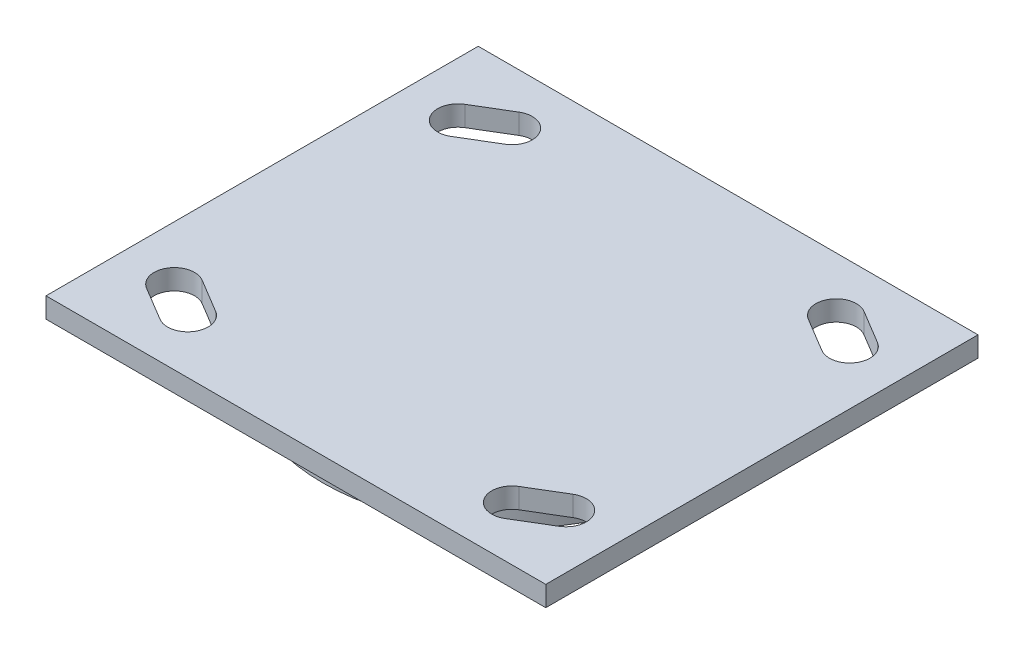
from build123d import *

# Parameters (mm, degrees)
SKETCH1_W               = 117.475
SKETCH1_H               = 4.7625
BOSS_EXTRUDE1_DEPTH     = 50.8
F_1_2_HOLES_DEPTH       = 78.803697293
SKETCH7_W               = 170.933784369
SKETCH7_H               = 70.3072
BOSS_EXTRUDE2_DEPTH     = 164.9349
CUT_EXTRUDE1_DEPTH      = 252.384886958
CUT_EXTRUDE1_DEPTH_BACK = 252.384886958
CUT_EXTRUDE3_DEPTH      = 208.174206511
CUT_EXTRUDE3_DEPTH_BACK = 208.174206511
SKETCH9_OUTSIDE_W       = 162.248
SKETCH9_OUTSIDE_H       = 251.148
BOSS_EXTRUDE3_DEPTH     = 7.9375
SKETCH11_OUTSIDE_W      = 1143.154
SKETCH11_OUTSIDE_H      = 1135.216
SKETCH11_OUTSIDE_R      = 11.1125
CUT_EXTRUDE4_DEPTH      = 255.208337191
CUT_EXTRUDE4_DRAFT      = -60
SKETCH12_R              = 10.795
BOSS_EXTRUDE4_DEPTH     = 64.77
SKETCH13_R              = 298.45
CUT_EXTRUDE5_DEPTH      = 254


with BuildPart() as part:
    # Sketch1 → Boss-Extrude1 (new, symmetric)
    with BuildSketch(Plane.XY):
        with Locations((0, -2.38125)):
            Rectangle(SKETCH1_W, SKETCH1_H)
    extrude(amount=BOSS_EXTRUDE1_DEPTH, both=True)

    # Sketch2 → 1-2 holes (cut, through all)
    with BuildSketch(Plane(origin=(0, 0, 0), x_dir=(1, 0, 0), z_dir=(0, 1, 0))):
        with BuildLine():
            Line((-35.649713965, 34.016189941), (-43.587213965, 29.253689941))
            ThreePointArc((-43.587213965, 29.253689941), (-50.121310059, 30.887213965), (-48.487786035, 37.421310059))
            Line((-48.487786035, 37.421310059), (-40.550286035, 42.183810059))
            ThreePointArc((-40.550286035, 42.183810059), (-34.016189941, 40.550286035), (-35.649713965, 34.016189941))
        make_face()
        with BuildLine():
            Line((-35.649713965, -34.016189941), (-43.587213965, -29.253689941))
            ThreePointArc((-43.587213965, -29.253689941), (-50.121310059, -30.887213965), (-48.487786035, -37.421310059))
            Line((-48.487786035, -37.421310059), (-40.550286035, -42.183810059))
            ThreePointArc((-40.550286035, -42.183810059), (-34.016189941, -40.550286035), (-35.649713965, -34.016189941))
        make_face()
        with BuildLine():
            Line((35.649713965, 34.016189941), (43.587213965, 29.253689941))
            ThreePointArc((43.587213965, 29.253689941), (50.121310059, 30.887213965), (48.487786035, 37.421310059))
            Line((48.487786035, 37.421310059), (40.550286035, 42.183810059))
            ThreePointArc((40.550286035, 42.183810059), (34.016189941, 40.550286035), (35.649713965, 34.016189941))
        make_face()
        with BuildLine():
            Line((35.649713965, -34.016189941), (43.587213965, -29.253689941))
            ThreePointArc((43.587213965, -29.253689941), (50.121310059, -30.887213965), (48.487786035, -37.421310059))
            Line((48.487786035, -37.421310059), (40.550286035, -42.183810059))
            ThreePointArc((40.550286035, -42.183810059), (34.016189941, -40.550286035), (35.649713965, -34.016189941))
        make_face()
    extrude(amount=-F_1_2_HOLES_DEPTH, mode=Mode.SUBTRACT)


with BuildPart() as body_2:
    # Sketch4 → Revolve1 (revolve)
    with BuildSketch(Plane.XY, mode=Mode.PRIVATE) as revolve1_sk:
        Polygon((0, -25.5651), (43.18, -25.5651), (43.18, -14.4526), (40.64, -14.4526), (40.64, -11.9126), (44.45, -11.9126), (44.45, -4.7625), (0, -4.7625), align=None)
    revolve(revolve1_sk.sketch.rotate(Axis((0, -4.7625, 0), (0, -1, 0)), 180), axis=Axis((0, -4.7625, 0), (0, -1, 0)))


with BuildPart() as body_3:
    # Sketch6 → Revolve2 (revolve)
    with BuildSketch(Plane(origin=(-63.5, 0, 0), x_dir=(0, 0, -1), z_dir=(1, 0, 0)), mode=Mode.PRIVATE) as revolve2_sk:
        with BuildLine():
            Line((-25.4, -68.58), (-25.4, -47.336363636))
            ThreePointArc((-25.4, -47.336363636), (-22.694731724, -40.805268276), (-16.163636364, -38.1))
            Line((-16.163636364, -38.1), (-14.143181818, -38.1))
            Line((-14.143181818, -38.1), (-14.143181818, -40.48125))
            Line((-14.143181818, -40.48125), (-10.102272727, -40.48125))
            Line((-10.102272727, -40.48125), (-10.102272727, -38.1))
            Line((-10.102272727, -38.1), (-6.061363636, -38.1))
            Line((-6.061363636, -38.1), (-6.061363636, -40.48125))
            Line((-6.061363636, -40.48125), (-2.020454545, -40.48125))
            Line((-2.020454545, -40.48125), (-2.020454545, -38.1))
            Line((-2.020454545, -38.1), (2.020454545, -38.1))
            Line((2.020454545, -38.1), (2.020454545, -40.48125))
            Line((2.020454545, -40.48125), (6.061363636, -40.48125))
            Line((6.061363636, -40.48125), (6.061363636, -38.1))
            Line((6.061363636, -38.1), (10.102272727, -38.1))
            Line((10.102272727, -38.1), (10.102272727, -40.48125))
            Line((10.102272727, -40.48125), (14.143181818, -40.48125))
            Line((14.143181818, -40.48125), (14.143181818, -38.1))
            Line((14.143181818, -38.1), (16.163636364, -38.1))
            ThreePointArc((16.163636364, -38.1), (22.694731724, -40.805268276), (25.4, -47.336363636))
            Line((25.4, -47.336363636), (25.4, -68.58))
            Line((25.4, -68.58), (26.67, -68.58))
            Line((26.67, -68.58), (26.67, -71.12))
            Line((26.67, -71.12), (23.495, -71.12))
            ThreePointArc((23.495, -71.12), (19.004871939, -72.979871939), (17.145, -77.47))
            ThreePointArc((17.145, -77.47), (15.476711089, -81.759997818), (11.348438966, -83.795836333))
            Line((11.348438966, -83.795836333), (5.438280517, -84.312908197))
            ThreePointArc((5.438280517, -84.312908197), (3.374144456, -85.330827454), (2.54, -87.475826363))
            Line((2.54, -87.475826363), (2.54, -93.6625))
            Line((2.54, -93.6625), (26.67, -93.6625))
            Line((26.67, -93.6625), (29.845, -93.6625))
            Line((29.845, -93.6625), (29.845, -114.3))
            Line((29.845, -114.3), (-29.845, -114.3))
            Line((-29.845, -114.3), (-29.845, -93.6625))
            Line((-29.845, -93.6625), (-26.67, -93.6625))
            Line((-26.67, -93.6625), (-2.54, -93.6625))
            Line((-2.54, -93.6625), (-2.54, -87.475826363))
            ThreePointArc((-2.54, -87.475826363), (-3.374144456, -85.330827454), (-5.438280517, -84.312908197))
            Line((-5.438280517, -84.312908197), (-11.348438966, -83.795836333))
            ThreePointArc((-11.348438966, -83.795836333), (-15.476711089, -81.759997818), (-17.145, -77.47))
            ThreePointArc((-17.145, -77.47), (-19.004871939, -72.979871939), (-23.495, -71.12))
            Line((-23.495, -71.12), (-26.67, -71.12))
            Line((-26.67, -71.12), (-26.67, -68.58))
            Line((-26.67, -68.58), (-25.4, -68.58))
        make_face()
    revolve(revolve2_sk.sketch.rotate(Axis((-63.5, -114.3, 111.145303652), (0, 0, -1)), 90), axis=Axis((-63.5, -114.3, 111.145303652), (0, 0, -1)))


with BuildPart() as body_4:
    # Sketch7 → Boss-Extrude2 (new body)
    with BuildSketch(Plane.XZ.offset(25.5651)):
        with Locations((-54.233107816, 0)):
            Rectangle(SKETCH7_W, SKETCH7_H)
    extrude(amount=BOSS_EXTRUDE2_DEPTH)

    # Sketch8 → Cut-Extrude1 (cut, two sides: drawn at the far end of the back side and taken through both)
    with BuildSketch(Plane.XY.offset(35.1536).offset(-CUT_EXTRUDE1_DEPTH_BACK)):
        with BuildLine():
            Line((313.51958325, 368.901075357), (31.233784369, -25.5651))
            Line((31.233784369, -25.5651), (-42.844161681, -129.081621811))
            ThreePointArc((-42.844161681, -129.081621811), (-78.281621811, -134.955838319), (-84.155838319, -99.518378189))
            Line((-84.155838319, -99.518378189), (-31.233784369, -25.5651))
            Line((-31.233784369, -25.5651), (251.052014512, 368.901075357))
            Line((251.052014512, 368.901075357), (251.052014512, -601.230535819))
            Line((251.052014512, -601.230535819), (313.51958325, -601.230535819))
            Line((313.51958325, -601.230535819), (313.51958325, 368.901075357))
        make_face()
    extrude(amount=CUT_EXTRUDE1_DEPTH + CUT_EXTRUDE1_DEPTH_BACK, mode=Mode.SUBTRACT)

    # Sketch9 outside → Cut-Extrude3 (cut, two sides: drawn at the far end of the back side and taken through both)
    with BuildSketch(Plane(origin=(0, -144.306693689, 0), x_dir=(0, 0, -1), z_dir=(-1, 0, 0)).offset(-CUT_EXTRUDE3_DEPTH_BACK)):
        with Locations((0, -49.057)):
            Rectangle(SKETCH9_OUTSIDE_W, SKETCH9_OUTSIDE_H)
        Polygon((35.1536, 46.193306311), (35.1536, -106.206693689), (29.815484467, -118.741593689), (27.046884467, -118.741593689), (32.385, -106.206693689), (32.385, 46.193306311), align=None, mode=Mode.SUBTRACT)
        Polygon((-27.046884467, -118.741593689), (-29.815484467, -118.741593689), (-35.1536, -106.206693689), (-35.1536, 46.193306311), (-32.385, 46.193306311), (-32.385, -106.206693689), align=None, mode=Mode.SUBTRACT)
    extrude(amount=CUT_EXTRUDE3_DEPTH + CUT_EXTRUDE3_DEPTH_BACK, mode=Mode.SUBTRACT)


with BuildPart() as cut_extrude3_piece_1:
    # of the separate pieces the step leaves, piece 1, a body of its own (cut_extrude3_pieces)
    add(body_4.part.solids().sort_by_distance((31.233784369, -25.5651, -29.815484467))[0])



with BuildPart() as cut_extrude3_piece_2:
    # of the separate pieces the step leaves, piece 2, a body of its own (cut_extrude3_pieces)
    add(body_4.part.solids().sort_by_distance((22.263625502, -38.1, 35.1536))[0])


with BuildPart() as body_6:
    # Sketch10 → Boss-Extrude3 (new body)
    with BuildSketch(Plane.XY.offset(35.1536)):
        Polygon((-63.5, -101.468390267), (-74.6125, -107.884195134), (-74.6125, -120.715804866), (-63.5, -127.131609733), (-52.3875, -120.715804866), (-52.3875, -107.884195134), align=None)
    extrude(amount=BOSS_EXTRUDE3_DEPTH)


with BuildPart() as cut_extrude4_tool:
    # Sketch11 outside → Cut-Extrude4 (with draft: the straight prism first)
    with BuildSketch(Plane.XY.offset(43.0911)):
        with Locations((-40.481, -95.25)):
            Rectangle(SKETCH11_OUTSIDE_W, SKETCH11_OUTSIDE_H)
        with Locations((-63.5, -114.3)):
            Circle(SKETCH11_OUTSIDE_R, mode=Mode.SUBTRACT)
    extrude(amount=-CUT_EXTRUDE4_DEPTH)
    # Cut-Extrude4: the draft: its side faces are tilted about the plane it starts from
    cut_extrude4_sides = [cut_extrude4_tool.faces().sort_by_distance(p)[0] for p in [
        (-40.481, -662.858, -84.513068595),
        (531.096, -95.25, -84.513068595),
        (-40.481, 472.358, -84.513068595),
        (-612.058, -95.25, -84.513068595),
        (-74.6125, -114.3, -84.513068595),
    ]]
    draft(cut_extrude4_sides, Plane.XY.offset(43.0911), CUT_EXTRUDE4_DRAFT)


with BuildPart() as body_6_1:
    add(body_6.part)

    # Cut-Extrude4: cut by cut_extrude4_tool
    add(cut_extrude4_tool.part, mode=Mode.SUBTRACT)


with BuildPart() as body_7:
    # Mirror1: mirrored copy
    add(body_6_1.part.mirror(Plane.XY))


with BuildPart() as cut_extrude3_piece_1_1:
    add(cut_extrude3_piece_1.part)

    add(cut_extrude3_piece_2.part)  # Boss-Extrude4 merges Cut-Extrude3 piece 2
    # Sketch12 → Boss-Extrude4 (add)
    with BuildSketch(Plane.XY.offset(-32.385)):
        with Locations(Location((-63.5, -114.3, 0), (0, 0, 180))):
            Circle(SKETCH12_R)
    extrude(amount=BOSS_EXTRUDE4_DEPTH)

    # Combine1: union body 7, body 6, body 2, part
    add(body_7.part)
    add(body_6_1.part)
    add(body_2.part)
    add(part.part)


with BuildPart() as cut_extrude5_tool:
    # Sketch13 → Cut-Extrude5 (new body)
    with BuildSketch(Plane.XZ.offset(11.9126)):
        Circle(SKETCH13_R)
    extrude(amount=CUT_EXTRUDE5_DEPTH)


with BuildPart() as body_3_1:
    add(body_3.part)

    # Cut-Extrude5: cut by cut_extrude5_tool
    add(cut_extrude5_tool.part, mode=Mode.SUBTRACT)


with BuildPart() as cut_extrude3_piece_1_2:
    add(cut_extrude3_piece_1_1.part)

    # Cut-Extrude5: cut by cut_extrude5_tool
    add(cut_extrude5_tool.part, mode=Mode.SUBTRACT)


solid = cut_extrude3_piece_1_2.part
